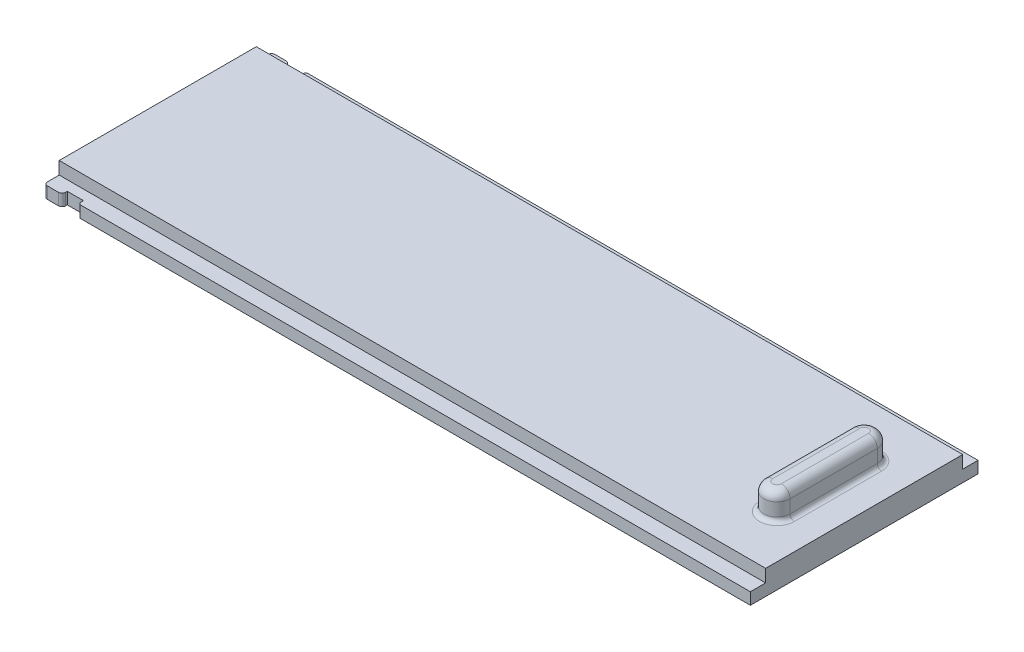
from build123d import *

# Parameters (mm, degrees)
SKETCH1_W           = 81
SKETCH1_H           = 29
BOSS_EXTRUDE1_DEPTH = 3
CUT_EXTRUDE2_DEPTH  = 81
CUT_EXTRUDE3_DEPTH  = 81
SKETCH6_W           = 1.85
SKETCH6_H           = 1.55
CUT_EXTRUDE5_DEPTH  = 0.6
FILLET6_R           = 0.4
CHAMFER2_SIZE       = 0.2
SKETCH7_W           = 1.85
SKETCH7_H           = 1.55
CUT_EXTRUDE6_DEPTH  = 0.6
FILLET7_R           = 0.4
CHAMFER3_SIZE       = 0.2
SKETCH11_W          = 81
SKETCH11_H          = 26.1
CUT_EXTRUDE7_DEPTH  = 0.2
FILLET8_R           = 0.4
BOSS_EXTRUDE2_DEPTH = 3
FILLET9_R           = 1
FILLET10_R          = 0.5


with BuildPart() as part:
    # Sketch1 → Boss-Extrude1 (new body)
    with BuildSketch(Plane(origin=(0, 0, 0), x_dir=(1, 0, 0), z_dir=(0, 1, 0))):
        with Locations((40.5, 14.5)):
            Rectangle(SKETCH1_W, SKETCH1_H)
    extrude(amount=BOSS_EXTRUDE1_DEPTH)

    # Sketch2 → Cut-Extrude2 (cut)
    with BuildSketch(Plane(origin=(81, 0, 0), x_dir=(0, 0, -1), z_dir=(1, 0, 0))):
        Polygon((0, 3), (3, 3), (3, 1.75), (1.25, 1.75), (1.25, 0), (0, 0), align=None)
        Polygon((29, 0), (27.75, 0), (27.75, 1.75), (26, 1.75), (26, 3), (29, 3), align=None)
    extrude(amount=-CUT_EXTRUDE2_DEPTH, mode=Mode.SUBTRACT)

    # Sketch4 → Cut-Extrude3 (cut)
    with BuildSketch(Plane(origin=(81, 0, 0), x_dir=(0, 0, -1), z_dir=(1, 0, 0))):
        Polygon((27.75, 0), (27.55, 0), (27.55, 1.55), (25.8, 1.55), (25.8, 3), (26, 3), (26, 1.75), (27.75, 1.75), align=None)
        Polygon((3.2, 3), (3, 3), (3, 1.75), (1.25, 1.75), (1.25, 0), (1.45, 0), (1.45, 1.55), (3.2, 1.55), align=None)
    extrude(amount=-CUT_EXTRUDE3_DEPTH, mode=Mode.SUBTRACT)

    # Sketch6 → Cut-Extrude5 (cut)
    with BuildSketch(Plane.XY.offset(-1.45)):
        with Locations((3, 0.775)):
            Rectangle(SKETCH6_W, SKETCH6_H)
    extrude(amount=-CUT_EXTRUDE5_DEPTH, mode=Mode.SUBTRACT)

    # Fillet6
    fillet6_edges = [part.edges().sort_by_distance(p)[0] for p in [
        (2.075, 0.775, -1.45),
    ]]
    fillet(fillet6_edges, radius=FILLET6_R)

    # Chamfer2
    chamfer2_edges = [part.edges().sort_by_distance(p)[0] for p in [
        (3.925, 0.775, -1.45),
    ]]
    chamfer(chamfer2_edges, length=CHAMFER2_SIZE)

    # Sketch7 → Cut-Extrude6 (cut)
    with BuildSketch(Plane(origin=(0, 0, -27.55), x_dir=(-1, 0, 0), z_dir=(0, 0, -1))):
        with Locations((-3, 0.775)):
            Rectangle(SKETCH7_W, SKETCH7_H)
    extrude(amount=-CUT_EXTRUDE6_DEPTH, mode=Mode.SUBTRACT)

    # Fillet7
    fillet7_edges = [part.edges().sort_by_distance(p)[0] for p in [
        (2.075, 0.775, -27.55),
    ]]
    fillet(fillet7_edges, radius=FILLET7_R)

    # Chamfer3
    chamfer3_edges = [part.edges().sort_by_distance(p)[0] for p in [
        (3.925, 0.775, -27.55),
    ]]
    chamfer(chamfer3_edges, length=CHAMFER3_SIZE)

    # Sketch11 → Cut-Extrude7 (cut)
    with BuildSketch(Plane(origin=(0, 0, 0), x_dir=(-1, 0, 0), z_dir=(0, -1, 0))):
        with Locations((-40.5, 14.5)):
            Rectangle(SKETCH11_W, SKETCH11_H)
    extrude(amount=-CUT_EXTRUDE7_DEPTH, mode=Mode.SUBTRACT)

    # Fillet8
    fillet8_edges = [part.edges().sort_by_distance(p)[0] for p in [
        (0, 0.875, -27.55),
        (0, 0.875, -1.45),
    ]]
    fillet(fillet8_edges, radius=FILLET8_R)

    # Sketch9 → Boss-Extrude2 (add)
    with BuildSketch(Plane(origin=(0, 3, 0), x_dir=(1, 0, 0), z_dir=(0, 1, 0))):
        with BuildLine():
            Line((74.5, 9.5), (74.5, 19.5))
            ThreePointArc((74.5, 19.5), (76, 21), (77.5, 19.5))
            Line((77.5, 19.5), (77.5, 9.5))
            ThreePointArc((77.5, 9.5), (76, 8), (74.5, 9.5))
        make_face()
    extrude(amount=BOSS_EXTRUDE2_DEPTH)

    # Fillet9
    fillet9_edges = [part.edges().sort_by_distance(p)[0] for p in [
        (76, 6, -8),
        (77.5, 6, -14.5),
        (76, 6, -21),
        (74.5, 6, -14.5),
    ]]
    fillet(fillet9_edges, radius=FILLET9_R)

    # Fillet10
    fillet10_edges = [part.edges().sort_by_distance(p)[0] for p in [
        (76, 3, -8),
        (77.5, 3, -14.5),
        (76, 3, -21),
        (74.5, 3, -14.5),
    ]]
    fillet(fillet10_edges, radius=FILLET10_R)


solid = part.part
